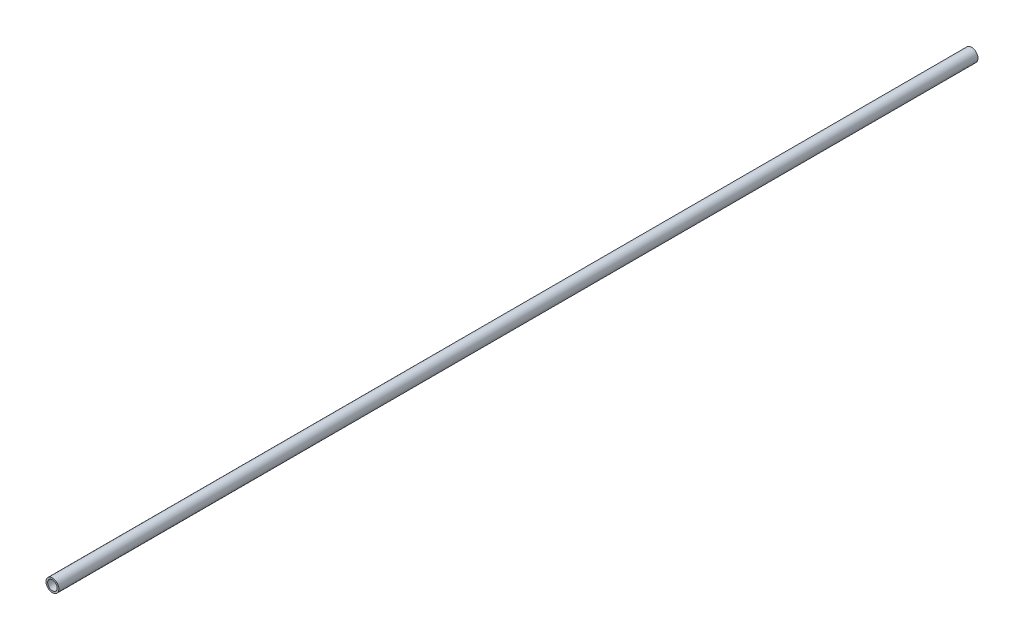
from build123d import *

# Parameters (mm, degrees)
SKETCH1_R           = 10.668
SKETCH1_R_2         = 7.8994
EXTRUDE_THIN1_DEPTH = 762


with BuildPart() as part:
    # Sketch1 → Extrude-Thin1 (new, symmetric)
    with BuildSketch(Plane.XY):
        Circle(SKETCH1_R)
        Circle(SKETCH1_R_2, mode=Mode.SUBTRACT)
    extrude(amount=EXTRUDE_THIN1_DEPTH, both=True)


solid = part.part
